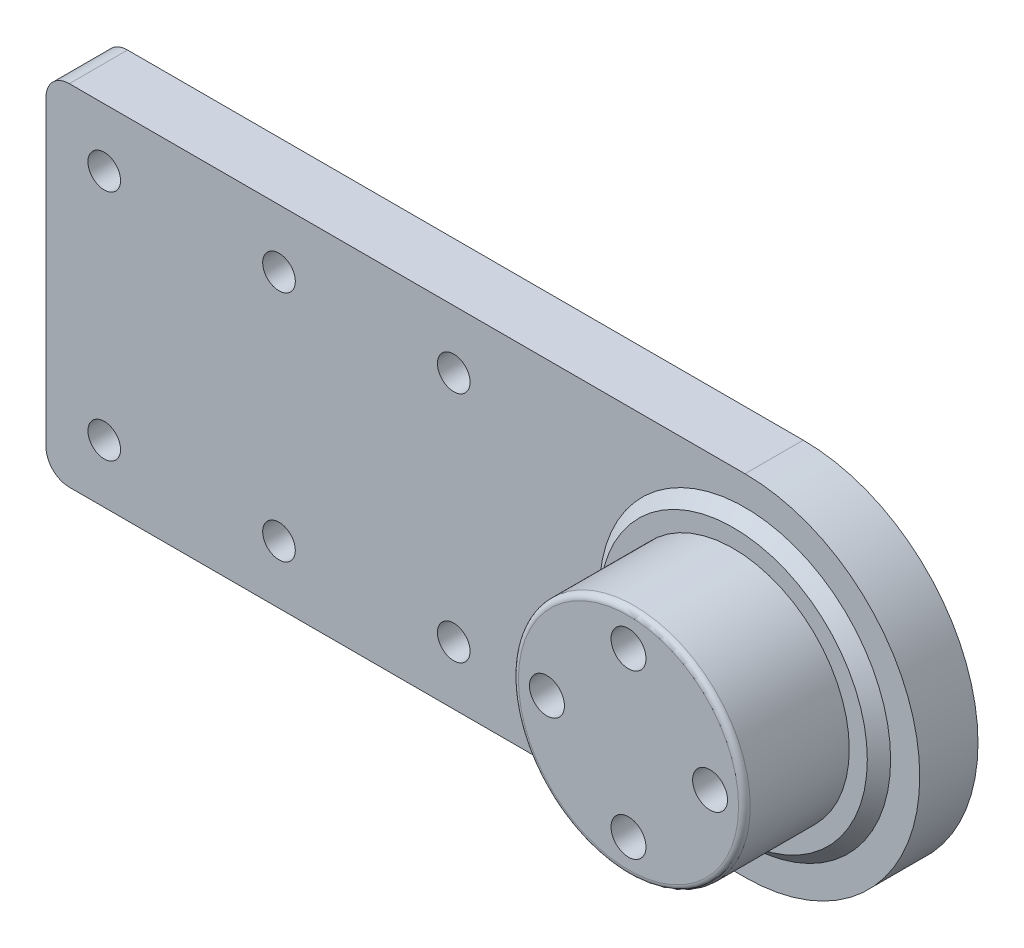
from build123d import *

# Parameters (mm, degrees)
BOSS_EXTRUDE1_DEPTH = 5
SKETCH3_R           = 9.95
BOSS_EXTRUDE2_DEPTH = 2
SKETCH4_R           = 1.5
CUT_EXTRUDE1_DEPTH  = 64.639610307
SKETCH5_R           = 1.4
CUT_EXTRUDE2_DEPTH  = 63.649820431
FILLET1_R           = 2
FILLET2_R           = 0.5


with BuildPart() as part:
    # Sketch1 → Revolve1 (revolve)
    with BuildSketch(Plane(origin=(0, 0, 0), x_dir=(1, 0, 0), z_dir=(0, 1, 0))):
        Polygon((0, 0), (9.95, 0), (9.95, 7), (11.5, 7), (12.5, 8), (0, 8), align=None)
    revolve(axis=Axis((0, 0, 0), (0, 0, -1)))

    # Sketch2 → Boss-Extrude1 (add)
    with BuildSketch(Plane(origin=(0, 0, -8), x_dir=(-1, 0, 0), z_dir=(0, 0, -1))):
        with BuildLine():
            Line((0, 15), (60, 15))
            Line((60, 15), (60, -15))
            Line((60, -15), (0, -15))
            ThreePointArc((0, -15), (-15, 0), (0, 15))
        make_face()
    extrude(amount=BOSS_EXTRUDE1_DEPTH)

    # Sketch3 → Boss-Extrude2 (add)
    with BuildSketch(Plane.XY):
        Circle(SKETCH3_R)
    extrude(amount=BOSS_EXTRUDE2_DEPTH)

    # Sketch4 → Cut-Extrude1 (cut, through all)
    with BuildSketch(Plane.XY.offset(2)):
        with Locations((0, 7)):
            Circle(SKETCH4_R)
        with Locations((7, 0)):
            Circle(SKETCH4_R)
        with Locations((0, -7)):
            Circle(SKETCH4_R)
        with Locations((-7, 0)):
            Circle(SKETCH4_R)
    extrude(amount=-CUT_EXTRUDE1_DEPTH, mode=Mode.SUBTRACT)

    # Sketch5 → Cut-Extrude2 (cut, through all)
    with BuildSketch(Plane.XY.offset(-8)):
        with Locations((-55, 10)):
            Circle(SKETCH5_R)
        with Locations((-55, -10)):
            Circle(SKETCH5_R)
        with Locations((-40, 10)):
            Circle(SKETCH5_R)
        with Locations((-40, -10)):
            Circle(SKETCH5_R)
        with Locations((-25, 10)):
            Circle(SKETCH5_R)
        with Locations((-25, -10)):
            Circle(SKETCH5_R)
    extrude(amount=-CUT_EXTRUDE2_DEPTH, mode=Mode.SUBTRACT)

    # Fillet1
    fillet1_edges = [part.edges().sort_by_distance(p)[0] for p in [
        (-60, -15, -10.5),
        (-60, 15, -10.5),
    ]]
    fillet(fillet1_edges, radius=FILLET1_R)

    # Fillet2
    fillet2_edges = [part.edges().sort_by_distance(p)[0] for p in [
        (-9.95, 0, 2),
    ]]
    fillet(fillet2_edges, radius=FILLET2_R)


solid = part.part
